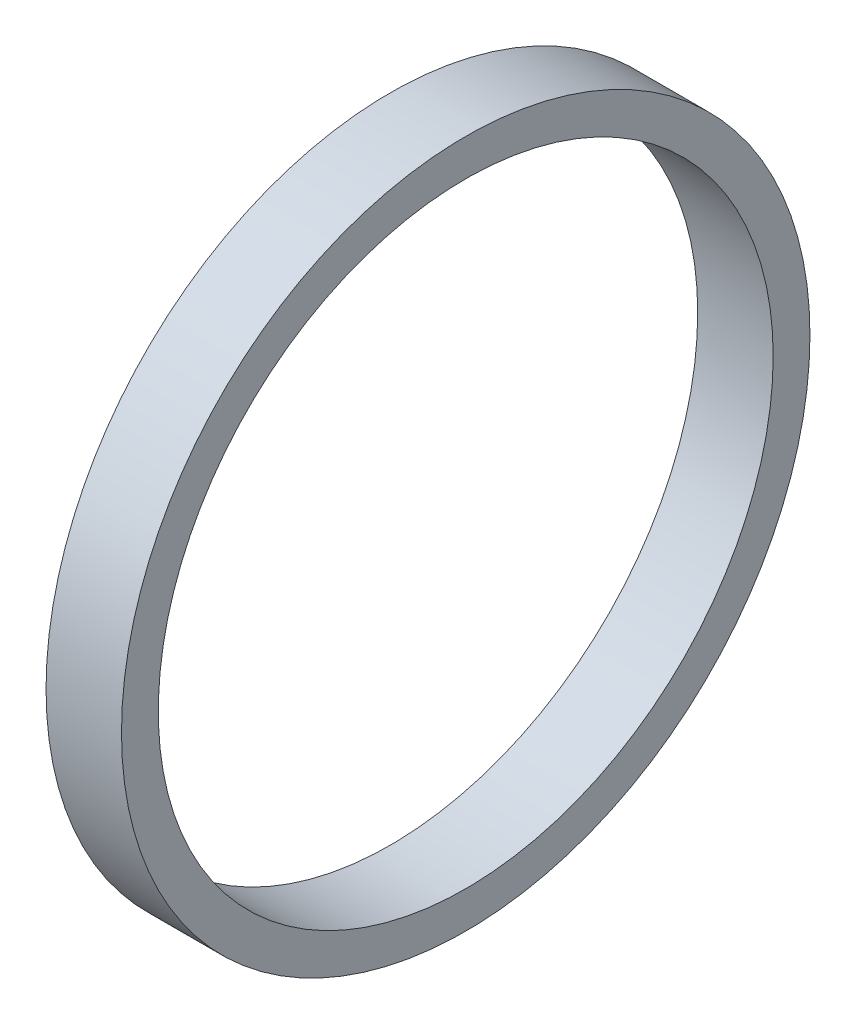
from build123d import *

# Parameters (mm, degrees)
SKETCH1_R           = 36.5
SKETCH1_R_2         = 32.6
BOSS_EXTRUDE1_DEPTH = 8


with BuildPart() as part:
    # Sketch1 → Boss-Extrude1 (new body)
    with BuildSketch(Plane(origin=(0, 0, 0), x_dir=(0, 0, -1), z_dir=(1, 0, 0))):
        Circle(SKETCH1_R)
        Circle(SKETCH1_R_2, mode=Mode.SUBTRACT)
    extrude(amount=BOSS_EXTRUDE1_DEPTH)


solid = part.part
